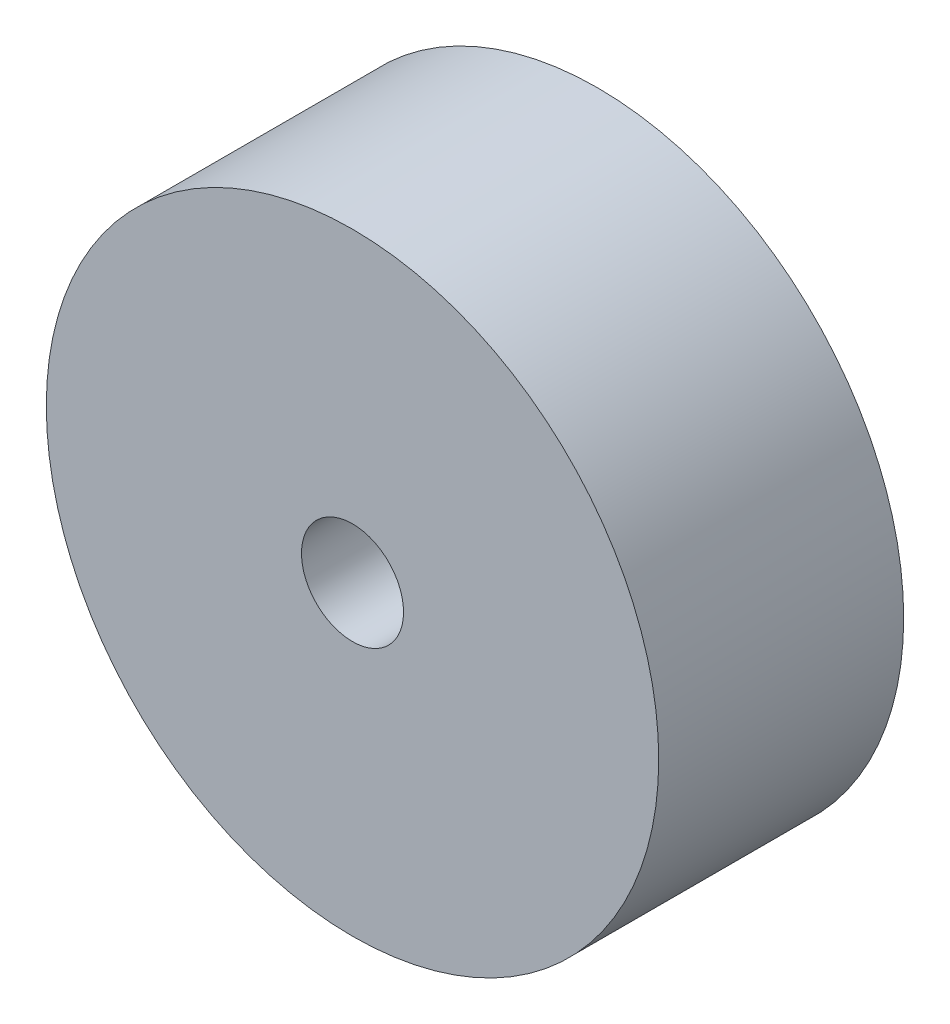
from build123d import *

# Parameters (mm, degrees)
SKETCH_1_R      = 7.5
SKETCH_1_R_2    = 1.25
EXTRUDE_1_DEPTH = 6


with BuildPart() as part:
    # 草圖1 → 填料-伸長1 (new body)
    with BuildSketch(Plane.XY):
        with Locations((-13.902883306, 4.645198473)):
            Circle(SKETCH_1_R)
        with Locations((-13.902883306, 4.645198473)):
            Circle(SKETCH_1_R_2, mode=Mode.SUBTRACT)
    extrude(amount=EXTRUDE_1_DEPTH)


solid = part.part
